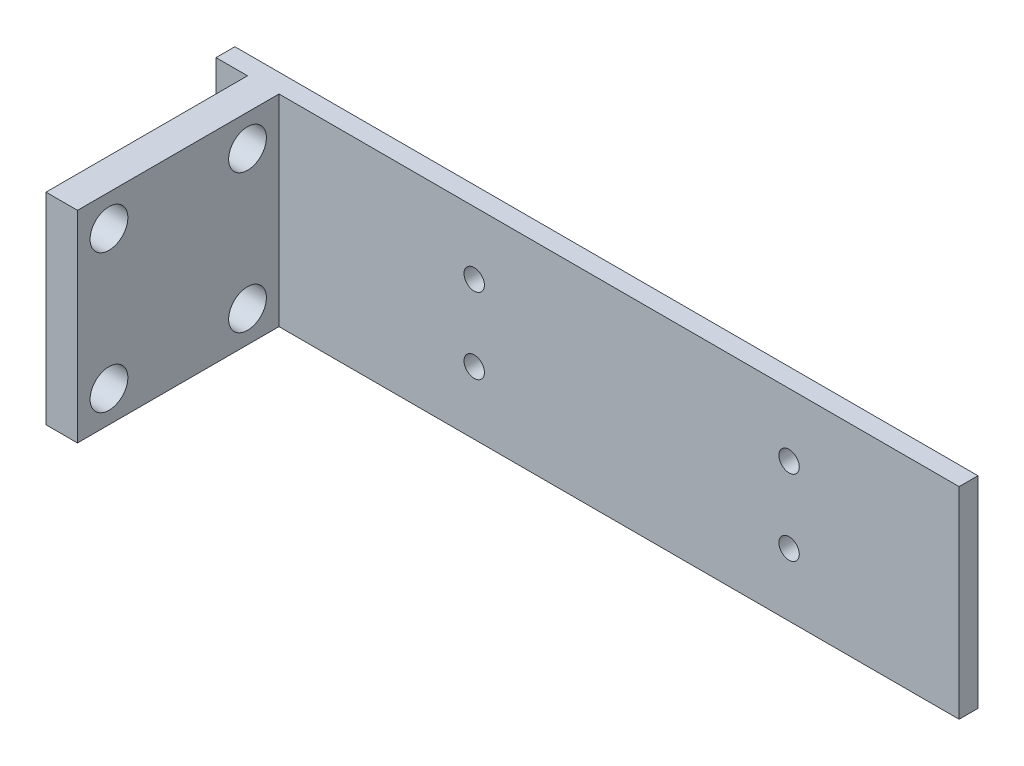
from build123d import *

# Parameters (mm, degrees)
SKETCH_1_W          = 118
SKETCH_1_H          = 32
EXTRUDE_1_DEPTH     = 3
SKETCH_2_R          = 1.62
CUT_EXTRUDE_1_DEPTH = 3
SKETCH_3_W          = 5
SKETCH_3_H          = 32
EXTRUDE_2_DEPTH     = 32
SKETCH_4_R          = 3
CUT_EXTRUDE_2_DEPTH = 32


with BuildPart() as part:
    # 草图1 → 凸台-拉伸1 (new body)
    with BuildSketch(Plane.XY):
        with Locations((-12.281632653, 6.717006803)):
            Rectangle(SKETCH_1_W, SKETCH_1_H)
    extrude(amount=EXTRUDE_1_DEPTH)

    # 草图2 → 切除-拉伸1 (cut)
    with BuildSketch(Plane.XY.offset(3)):
        with Locations((-30.281632653, 12.717006803)):
            Circle(SKETCH_2_R)
        with Locations((-30.281632653, 0.717006803)):
            Circle(SKETCH_2_R)
        with Locations((19.718367347, 12.717006803)):
            Circle(SKETCH_2_R)
        with Locations((19.718367347, 0.717006803)):
            Circle(SKETCH_2_R)
    extrude(amount=-CUT_EXTRUDE_1_DEPTH, mode=Mode.SUBTRACT)

    # 草图3 → 凸台-拉伸2 (add)
    with BuildSketch(Plane.XY.offset(3)):
        with Locations((-63.781632653, 6.717006803)):
            Rectangle(SKETCH_3_W, SKETCH_3_H)
    extrude(amount=EXTRUDE_2_DEPTH)

    # 草图4 → 切除-拉伸2 (cut)
    with BuildSketch(Plane.ZY.offset(71.281632653)):
        with Locations((30, 17.717006803)):
            Circle(SKETCH_4_R)
        with Locations((30, -4.282993197)):
            Circle(SKETCH_4_R)
        with Locations((8, 17.717006803)):
            Circle(SKETCH_4_R)
        with Locations((8, -4.282993197)):
            Circle(SKETCH_4_R)
    extrude(amount=-CUT_EXTRUDE_2_DEPTH, mode=Mode.SUBTRACT)


solid = part.part
